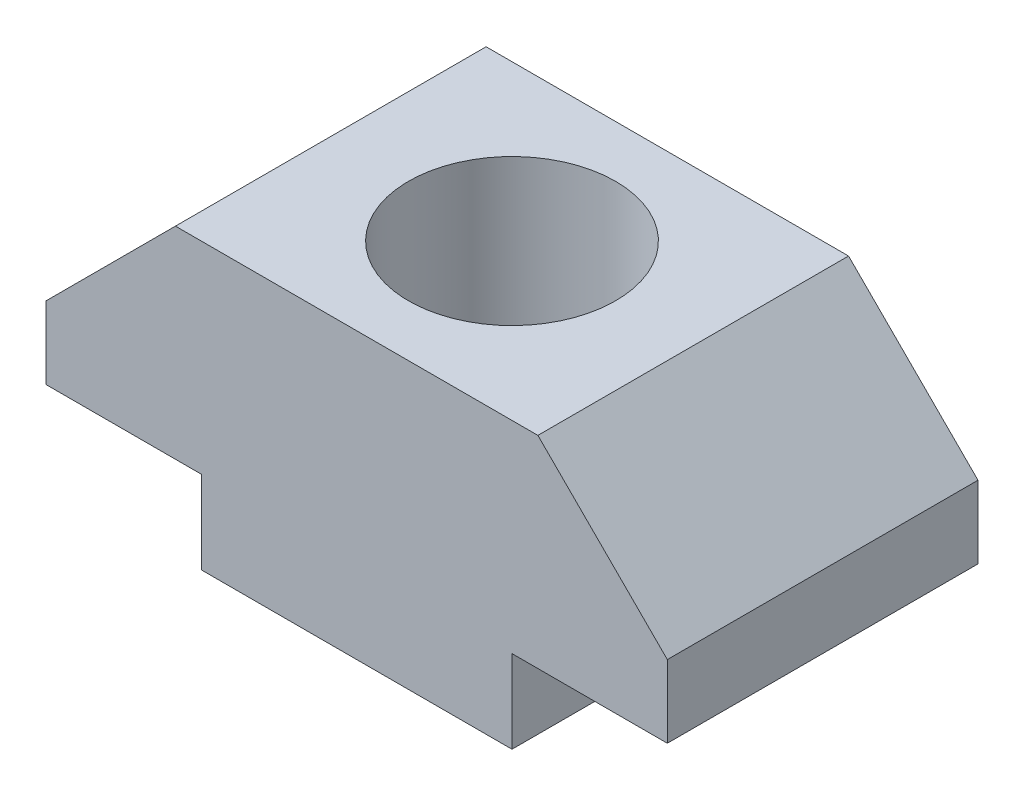
from build123d import *

# Parameters (mm, degrees)
EXTRUDE1_DEPTH     = 3
CUT_EXTRUDE1_REACH = 10.675
SKETCH2_R          = 2


with BuildPart() as part:
    # Sketch1 → Extrude1 (new, symmetric)
    with BuildSketch(Plane.XY):
        Polygon((-3, 0), (3, 0), (3, 1.6), (6, 1.6), (6, 3), (3.5, 5.5), (-3.5, 5.5), (-6, 3), (-6, 1.6), (-3, 1.6), align=None)
    extrude(amount=EXTRUDE1_DEPTH, both=True)

    # Sketch2 → Cut-Extrude1 (cut, up to next)
    with BuildSketch(Plane(origin=(0, 0, 0), x_dir=(1, 0, 0), z_dir=(0, 1, 0)), mode=Mode.PRIVATE) as cut_extrude1_sk1:
        with Locations(Location((0, 0, 0), (0, 0, 90))):
            Circle(SKETCH2_R)
    cut_extrude1_tool1 = extrude(cut_extrude1_sk1.sketch, amount=CUT_EXTRUDE1_REACH, mode=Mode.PRIVATE) & part.part
    add(cut_extrude1_tool1.solids().sort_by_distance((0, 0, 0))[0], mode=Mode.SUBTRACT)


solid = part.part
